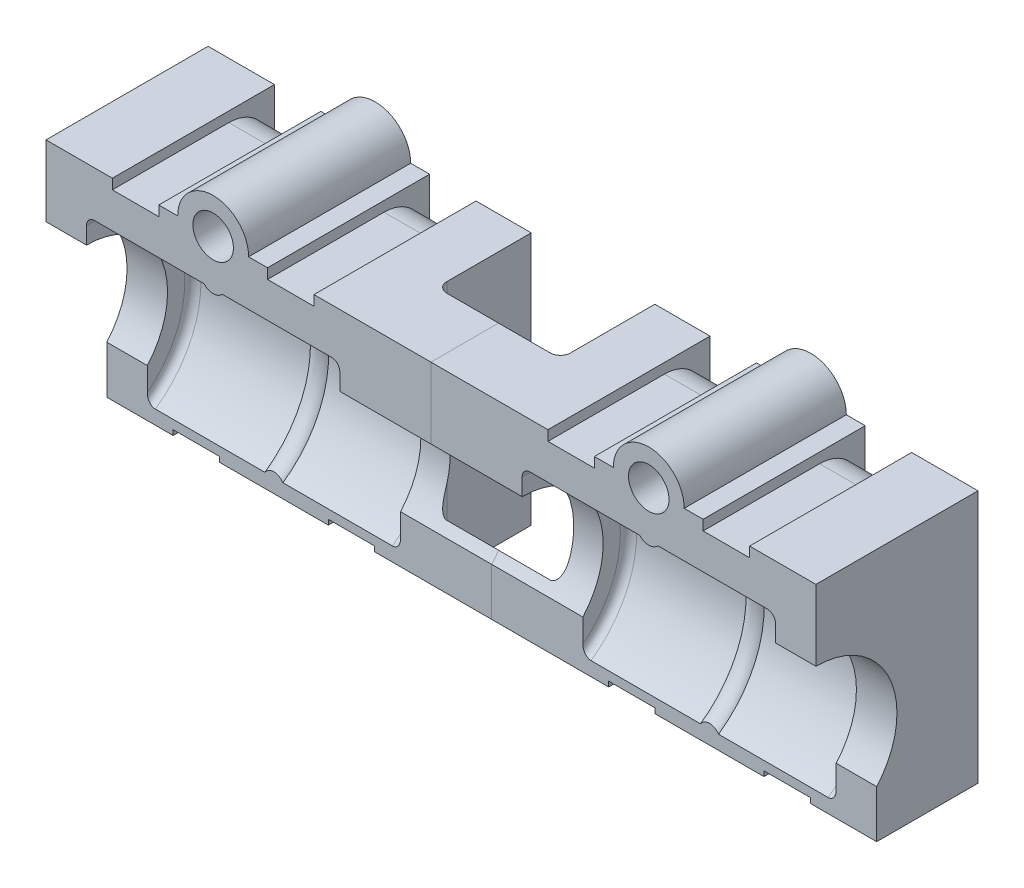
from build123d import *

# Parameters (mm, degrees)
BOSS_EXTRUDE1_DEPTH = 38
SKETCH4_R           = 2
CUT_EXTRUDE1_DEPTH  = 38
SKETCH11_W          = 4.582575695
SKETCH11_H          = 1
CUT_EXTRUDE2_DEPTH  = 30
SKETCH13_W          = 4.582575695
SKETCH13_H          = 1
CUT_EXTRUDE3_DEPTH  = 30
FILLET1_R           = 4
CUT_EXTRUDE4_DEPTH  = 40


with BuildPart() as part:
    # Sketch5 → Boss-Extrude1 (new body)
    with BuildSketch(Plane(origin=(0, 0, 0), x_dir=(0, 0, -1), z_dir=(1, 0, 0))):
        with BuildLine():
            Line((0, 18.5), (16, 18.5))
            Line((16, 18.5), (16, -10))
            Line((16, -10), (6, -10))
            Line((6, -10), (6, -5.291502622))
            ThreePointArc((6, -5.291502622), (7.291502622, 3.291502622), (0, 8))
            Line((0, 8), (0, 18.5))
        make_face()
    extrude(amount=BOSS_EXTRUDE1_DEPTH)

    # Sketch2 → Cut-Revolve1 (revolve, cut)
    with BuildSketch(Plane.XY):
        with BuildLine():
            Line((22.394427191, 10.5), (33.2, 10.5))
            ThreePointArc((33.2, 10.5), (33.765685425, 10.265685425), (34, 9.7))
            Line((34, 9.7), (34, 0))
            Line((34, 0), (9, 0))
            Line((9, 0), (9, 9.7))
            ThreePointArc((9, 9.7), (9.234314575, 10.265685425), (9.8, 10.5))
            Line((9.8, 10.5), (20.605572809, 10.5))
            ThreePointArc((20.605572809, 10.5), (21.5, 10.1), (22.394427191, 10.5))
        make_face()
    revolve(axis=Axis((0, 0, 0), (1, 0, 0)), mode=Mode.SUBTRACT)

    # Sketch4 → Cut-Extrude1 (cut)
    with BuildSketch(Plane.XY):
        with Locations((21.5, 15)):
            Circle(SKETCH4_R)
        with BuildLine():
            Line((11.549695158, 15), (0, 15))
            Line((0, 15), (0, 25))
            Line((0, 25), (38, 25))
            Line((38, 25), (38, 15))
            Line((38, 15), (31.450304842, 15))
            Line((31.450304842, 15), (31.450304842, 14))
            Line((31.450304842, 14), (26.867729147, 14))
            Line((26.867729147, 14), (26.867729147, 15))
            Line((26.867729147, 15), (25, 15))
            ThreePointArc((25, 15), (21.5, 18.5), (18, 15))
            Line((18, 15), (16.132270853, 15))
            Line((16.132270853, 15), (16.132270853, 14))
            Line((16.132270853, 14), (11.549695158, 14))
            Line((11.549695158, 14), (11.549695158, 15))
        make_face()
    extrude(amount=-CUT_EXTRUDE1_DEPTH, mode=Mode.SUBTRACT)

    # Sketch11 → Cut-Extrude2 (cut)
    with BuildSketch(Plane.XY):
        with Locations((29.159016994, -10)):
            Rectangle(SKETCH11_W, SKETCH11_H)
        with Locations((13.840983006, -10)):
            Rectangle(SKETCH11_W, SKETCH11_H)
    extrude(amount=-CUT_EXTRUDE2_DEPTH, mode=Mode.SUBTRACT)

    # Sketch13 → Cut-Extrude3 (cut)
    with BuildSketch(Plane.XZ.offset(10)):
        with Locations((29.159016994, -16)):
            Rectangle(SKETCH13_W, SKETCH13_H)
        with Locations((13.840983006, -16)):
            Rectangle(SKETCH13_W, SKETCH13_H)
    extrude(amount=-CUT_EXTRUDE3_DEPTH, mode=Mode.SUBTRACT)

    # Fillet1
    fillet1_edges = [part.edges().sort_by_distance(p)[0] for p in [
        (13.840983006, -9.5, -15.5),
        (29.159016994, -9.5, -15.5),
        (13.840983006, 14, -15.5),
        (29.159016994, 14, -15.5),
    ]]
    fillet(fillet1_edges, radius=FILLET1_R)


with BuildPart() as body_2:
    # Mirror1: mirrored copy
    add(part.part.mirror(Plane(origin=(0, 0, 0), x_dir=(0, 0, 1), z_dir=(1, 0, 0))))


with BuildPart() as cut_extrude4_tool:
    # Sketch14 → Cut-Extrude4 (new body)
    with BuildSketch(Plane.XZ.offset(10)):
        with BuildLine():
            Line((6.1, -17.67179677), (6.1, -7.67179677))
            ThreePointArc((6.1, -7.67179677), (5.807106781, -6.964689989), (5.1, -6.67179677))
            Line((5.1, -6.67179677), (-5.1, -6.67179677))
            ThreePointArc((-5.1, -6.67179677), (-5.807106781, -6.964689989), (-6.1, -7.67179677))
            Line((-6.1, -7.67179677), (-6.1, -17.67179677))
            ThreePointArc((-6.1, -17.67179677), (-5.807106781, -18.378903551), (-5.1, -18.67179677))
            Line((-5.1, -18.67179677), (5.1, -18.67179677))
            ThreePointArc((5.1, -18.67179677), (5.807106781, -18.378903551), (6.1, -17.67179677))
        make_face()
    extrude(amount=-CUT_EXTRUDE4_DEPTH)


with BuildPart() as part_1:
    add(part.part)

    # Cut-Extrude4: cut by cut_extrude4_tool
    add(cut_extrude4_tool.part, mode=Mode.SUBTRACT)


with BuildPart() as body_2_1:
    add(body_2.part)

    # Cut-Extrude4: cut by cut_extrude4_tool
    add(cut_extrude4_tool.part, mode=Mode.SUBTRACT)


solid = Compound([part_1.part, body_2_1.part])
